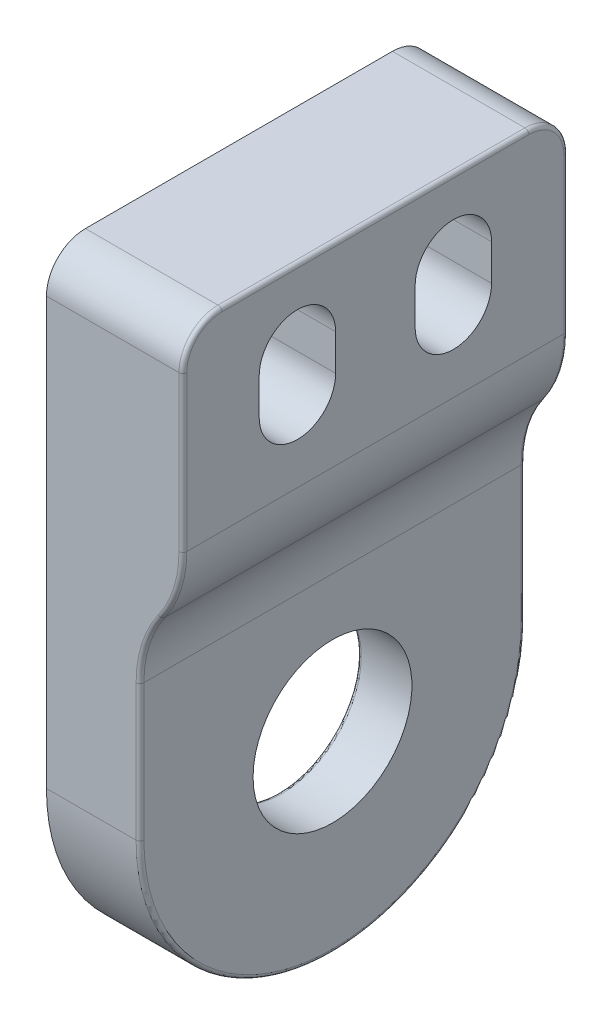
from build123d import *

# Parameters (mm, degrees)
SKETCH6_R               = 5.17525
BOSS_EXTRUDE1_DEPTH     = 6.35
FILLET1_R               = 2.54
CUT_EXTRUDE2_DEPTH      = 34.421305377
CUT_EXTRUDE2_DEPTH_BACK = 34.421305377
BOSS_EXTRUDE6_START     = 2.54
BOSS_EXTRUDE6_DEPTH     = 2.54
FILLET2_R               = 0.254
FILLET3_R               = 0.254


with BuildPart() as part:
    # Sketch6 → Boss-Extrude1 (new body)
    with BuildSketch(Plane(origin=(0, 0, 0), x_dir=(0, 0, -1), z_dir=(1, 0, 0))):
        with BuildLine():
            Line((12.54125, 0), (12.54125, 30.32125))
            Line((12.54125, 30.32125), (-12.54125, 30.32125))
            Line((-12.54125, 30.32125), (-12.54125, 0))
            ThreePointArc((-12.54125, 0), (0, -12.54125), (12.54125, 0))
        make_face()
        Circle(SKETCH6_R, mode=Mode.SUBTRACT)
        with BuildLine():
            Line((-2.5908, 25.24125), (-2.5908, 22.89175))
            ThreePointArc((-2.5908, 22.89175), (-5.08, 20.40255), (-7.5692, 22.89175))
            Line((-7.5692, 22.89175), (-7.5692, 25.24125))
            ThreePointArc((-7.5692, 25.24125), (-5.08, 27.73045), (-2.5908, 25.24125))
        make_face(mode=Mode.SUBTRACT)
        with BuildLine():
            Line((7.5692, 25.24125), (7.5692, 22.89175))
            ThreePointArc((7.5692, 22.89175), (5.08, 20.40255), (2.5908, 22.89175))
            Line((2.5908, 22.89175), (2.5908, 25.24125))
            ThreePointArc((2.5908, 25.24125), (5.08, 27.73045), (7.5692, 25.24125))
        make_face(mode=Mode.SUBTRACT)
    extrude(amount=BOSS_EXTRUDE1_DEPTH)

    # Fillet1
    fillet1_edges = [part.edges().sort_by_distance(p)[0] for p in [
        (3.175, 30.32125, 12.54125),
        (3.175, 30.32125, -12.54125),
    ]]
    fillet(fillet1_edges, radius=FILLET1_R)

    # Sketch11 → Cut-Extrude2 (cut, two sides: drawn at the far end of the back side and taken through both)
    with BuildSketch(Plane.XY.offset(-CUT_EXTRUDE2_DEPTH_BACK)):
        with BuildLine():
            Line((3.556, -12.54125), (3.556, 8.89))
            ThreePointArc((3.556, 8.89), (3.913642945, 11.19706957), (4.953, 13.287575582))
            ThreePointArc((4.953, 13.287575582), (5.992357055, 15.378081594), (6.35, 17.685151164))
            Line((6.35, 17.685151164), (6.35, -12.54125))
            Line((6.35, -12.54125), (3.556, -12.54125))
        make_face()
    extrude(amount=CUT_EXTRUDE2_DEPTH + CUT_EXTRUDE2_DEPTH_BACK, mode=Mode.SUBTRACT)

    # Sketch18 → Boss-Extrude6 (add)
    with BuildSketch(Plane.ZY.offset(BOSS_EXTRUDE6_START)):
        with BuildLine():
            Line((-12.54125, 27.78125), (-12.54125, 0))
            ThreePointArc((-12.54125, 0), (0, -12.54125), (12.54125, 0))
            Line((12.54125, 0), (12.54125, 27.78125))
            ThreePointArc((12.54125, 27.78125), (11.797301224, 29.577301224), (10.00125, 30.32125))
            Line((10.00125, 30.32125), (-10.00125, 30.32125))
            ThreePointArc((-10.00125, 30.32125), (-11.797301224, 29.577301224), (-12.54125, 27.78125))
        make_face()
        with BuildLine():
            ThreePointArc((11.1125, 0), (-6.369812841, -9.105665304), (-3.81, 10.438944211))
            Line((-3.81, 10.438944211), (-3.81, 12.978944211))
            Line((-3.81, 12.978944211), (0, 12.978944211))
            Line((0, 12.978944211), (3.81, 12.978944211))
            Line((3.81, 12.978944211), (3.81, 10.438944211))
            ThreePointArc((3.81, 10.438944211), (9.105665304, 6.369812841), (11.1125, 0))
        make_face(mode=Mode.SUBTRACT)
        with BuildLine():
            Line((-2.5908, 25.24125), (-2.5908, 22.89175))
            ThreePointArc((-2.5908, 22.89175), (-5.08, 20.40255), (-7.5692, 22.89175))
            Line((-7.5692, 22.89175), (-7.5692, 25.24125))
            ThreePointArc((-7.5692, 25.24125), (-5.08, 27.73045), (-2.5908, 25.24125))
        make_face(mode=Mode.SUBTRACT)
        with BuildLine():
            Line((2.5908, 22.89175), (2.5908, 25.24125))
            ThreePointArc((2.5908, 25.24125), (5.08, 27.73045), (7.5692, 25.24125))
            Line((7.5692, 25.24125), (7.5692, 22.89175))
            ThreePointArc((7.5692, 22.89175), (5.08, 20.40255), (2.5908, 22.89175))
        make_face(mode=Mode.SUBTRACT)
    extrude(amount=-BOSS_EXTRUDE6_DEPTH)

    # Fillet2
    fillet2_edges = [part.edges().sort_by_distance(p)[0] for p in [
        (-2.54, 20.40255, -5.08),
        (-2.54, 24.0665, 2.5908),
        (-2.54, 27.73045, 5.08),
        (-2.54, 24.0665, 7.5692),
        (-2.54, 20.40255, 5.08),
        (0, 0, 5.17525),
        (-2.54, -11.1125, 0),
        (-1.27, 10.438944211, 3.81),
        (-1.27, 10.438944211, -3.81),
        (-1.27, 12.978944211, -3.81),
        (-1.27, 12.978944211, 3.81),
        (-2.54, 11.708944211, -3.81),
        (-2.54, 12.978944211, 0),
        (-2.54, 11.708944211, 3.81),
        (-2.54, 24.0665, -7.5692),
        (-2.54, 27.73045, -5.08),
        (-2.54, 24.0665, -2.5908),
    ]]
    fillet(fillet2_edges, radius=FILLET2_R)

    # Fillet3
    fillet3_edges = [part.edges().sort_by_distance(p)[0] for p in [
        (6.35, 30.32125, 0),
        (6.35, 22.733200582, 12.54125),
        (6.35, 29.577301224, 11.797301224),
        (6.35, 29.577301224, -11.797301224),
        (6.35, 22.733200582, -12.54125),
        (5.992357055, 15.378081594, 12.54125),
        (3.913642945, 11.19706957, 12.54125),
        (3.556, 4.445, 12.54125),
        (3.556, 4.445, -12.54125),
        (3.556, -12.54125, 0),
        (3.913642945, 11.19706957, -12.54125),
        (5.992357055, 15.378081594, -12.54125),
    ]]
    fillet(fillet3_edges, radius=FILLET3_R)


solid = part.part
